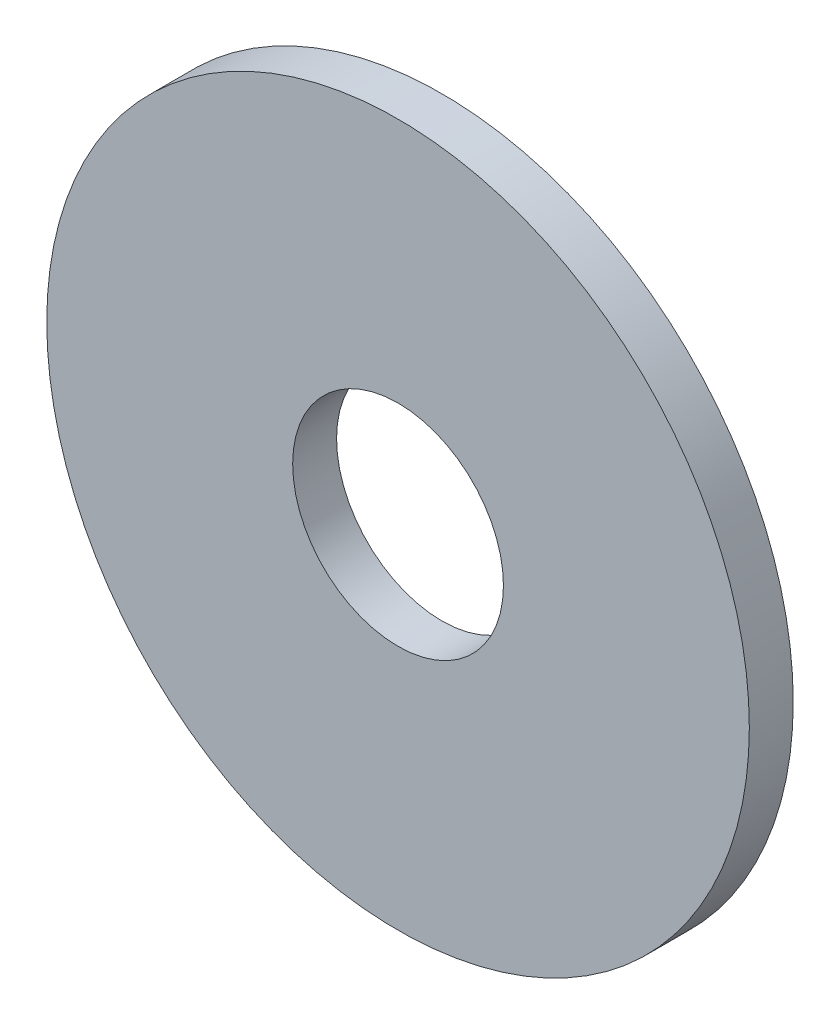
from build123d import *

# Parameters (mm, degrees)
SKETCH1_R           = 12.7
SKETCH1_R_2         = 3.81
BOSS_EXTRUDE1_DEPTH = 1.5875


with BuildPart() as part:
    # Sketch1 → Boss-Extrude1 (new body)
    with BuildSketch(Plane.XY):
        Circle(SKETCH1_R)
        Circle(SKETCH1_R_2, mode=Mode.SUBTRACT)
    extrude(amount=BOSS_EXTRUDE1_DEPTH)


solid = part.part
